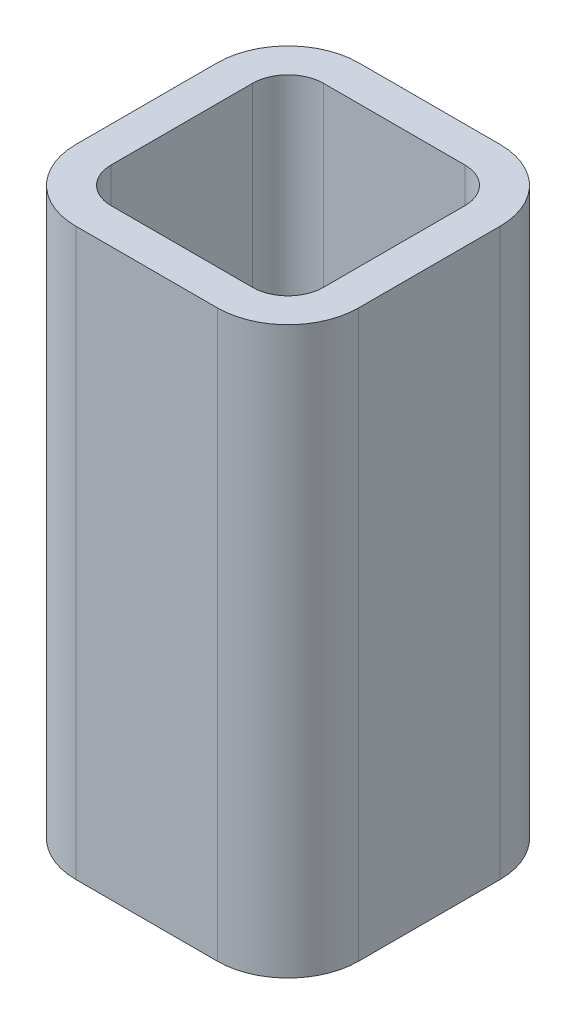
from build123d import *

# Parameters (mm, degrees)
BOSS_EXTRUDE1_DEPTH = 101.6


with BuildPart() as part:
    # Sketch1 → Boss-Extrude1 (new body)
    with BuildSketch(Plane(origin=(0, 0, 0), x_dir=(1, 0, 0), z_dir=(0, 1, 0))):
        with BuildLine():
            Line((-12.7, 0), (-38.1, 0))
            ThreePointArc((-38.1, 0), (-47.080256121, 3.719743879), (-50.8, 12.7))
            Line((-50.8, 12.7), (-50.8, 38.1))
            ThreePointArc((-50.8, 38.1), (-47.080256121, 47.080256121), (-38.1, 50.8))
            Line((-38.1, 50.8), (-12.7, 50.8))
            ThreePointArc((-12.7, 50.8), (-3.719743879, 47.080256121), (0, 38.1))
            Line((0, 38.1), (0, 12.7))
            ThreePointArc((0, 12.7), (-3.719743879, 3.719743879), (-12.7, 0))
        make_face()
        with BuildLine():
            Line((-12.7, 6.35), (-38.1, 6.35))
            ThreePointArc((-38.1, 6.35), (-42.590128061, 8.209871939), (-44.45, 12.7))
            Line((-44.45, 12.7), (-44.45, 38.1))
            ThreePointArc((-44.45, 38.1), (-42.590128061, 42.590128061), (-38.1, 44.45))
            Line((-38.1, 44.45), (-12.7, 44.45))
            ThreePointArc((-12.7, 44.45), (-8.209871939, 42.590128061), (-6.35, 38.1))
            Line((-6.35, 38.1), (-6.35, 12.7))
            ThreePointArc((-6.35, 12.7), (-8.209871939, 8.209871939), (-12.7, 6.35))
        make_face(mode=Mode.SUBTRACT)
    extrude(amount=BOSS_EXTRUDE1_DEPTH)


solid = part.part
